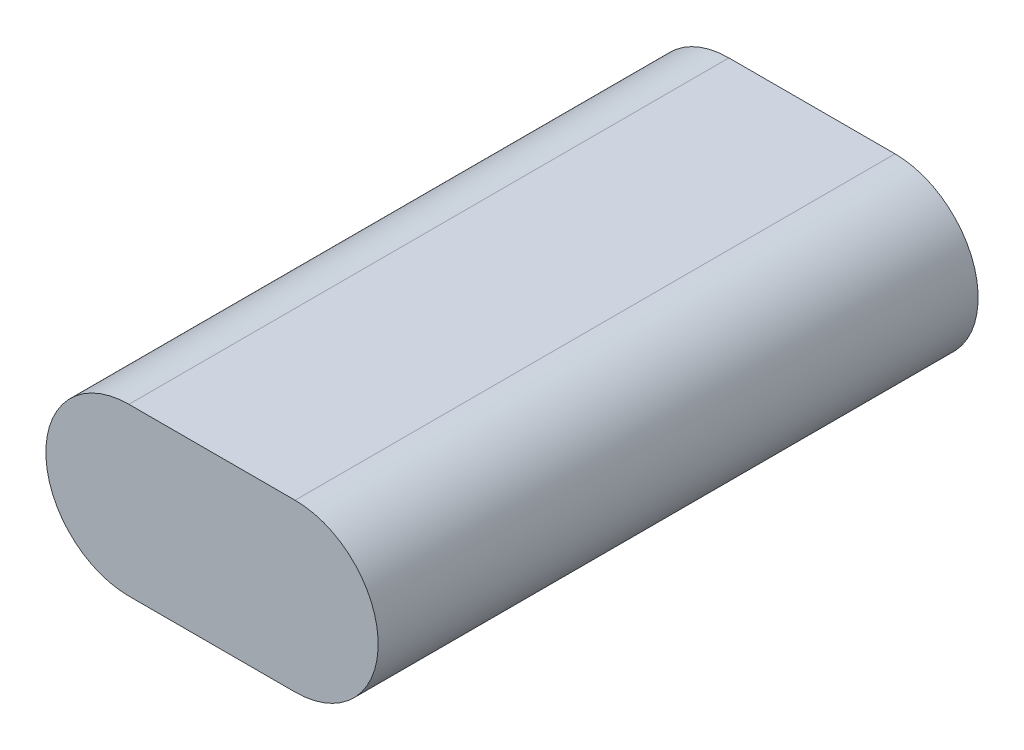
from build123d import *

# Parameters (mm, degrees)
SCHIZZO1_R                   = 9
ESTRUSIONE_ESTRUSIONE1_DEPTH = 65


with BuildPart() as part:
    # Schizzo1 → Estrusione-Estrusione1 (new body)
    with BuildSketch(Plane.XY):
        with Locations((18, 0)):
            Circle(SCHIZZO1_R)
        Circle(SCHIZZO1_R)
        with BuildLine():
            Line((18, 9), (0, 9))
            ThreePointArc((0, 9), (6.363961031, 6.363961031), (9, 0))
            ThreePointArc((9, 0), (11.636038969, 6.363961031), (18, 9))
        make_face()
        with BuildLine():
            ThreePointArc((18, -9), (11.636038969, -6.363961031), (9, 0))
            ThreePointArc((9, 0), (6.363961031, -6.363961031), (0, -9))
            Line((0, -9), (18, -9))
        make_face()
    extrude(amount=ESTRUSIONE_ESTRUSIONE1_DEPTH)


solid = part.part
